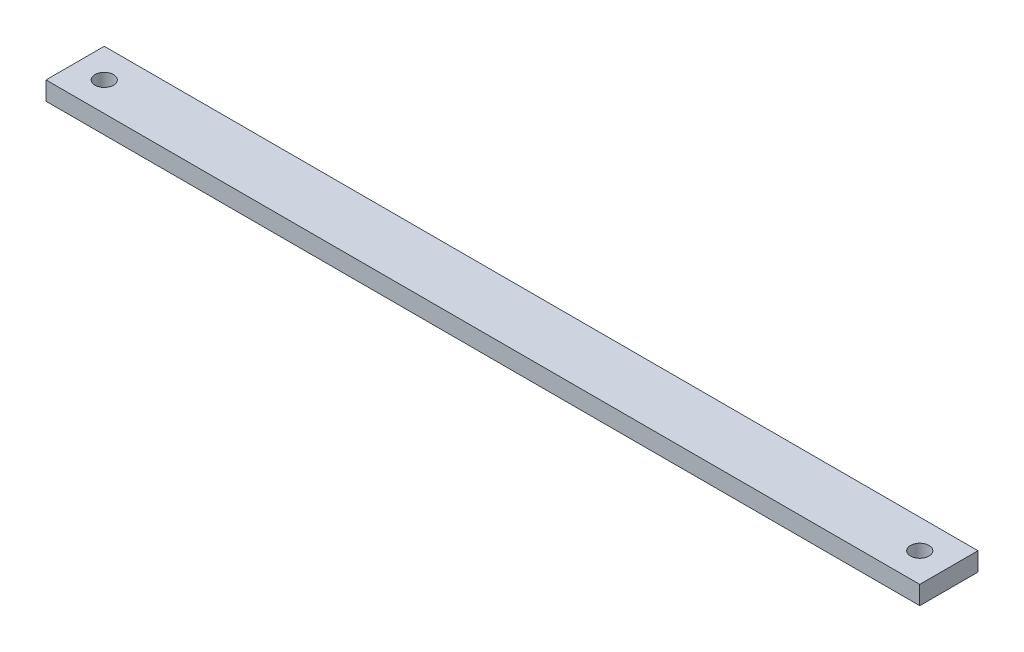
from build123d import *

# Parameters (mm, degrees)
SKETCH1_W           = 300
SKETCH1_H           = 20
BOSS_EXTRUDE1_DEPTH = 6.35
SKETCH2_R           = 3.175
CUT_EXTRUDE1_DEPTH  = 6.35


with BuildPart() as part:
    # Sketch1 → Boss-Extrude1 (new body)
    with BuildSketch(Plane(origin=(0, 0, 0), x_dir=(1, 0, 0), z_dir=(0, 1, 0))):
        Rectangle(SKETCH1_W, SKETCH1_H)
    extrude(amount=BOSS_EXTRUDE1_DEPTH)

    # Sketch2 → Cut-Extrude1 (cut)
    with BuildSketch(Plane(origin=(0, 0, 0), x_dir=(-1, 0, 0), z_dir=(0, -1, 0))):
        with Locations(Location((140, 0, 0), (0, 0, 90))):
            Circle(SKETCH2_R)
    cut_extrude1 = extrude(amount=-CUT_EXTRUDE1_DEPTH, mode=Mode.SUBTRACT)

    # Mirror1: Cut-Extrude1 across plane
    add(cut_extrude1.mirror(Plane(origin=(0, 0, 0), x_dir=(0, 0, 1), z_dir=(1, 0, 0))), mode=Mode.SUBTRACT)


solid = part.part
